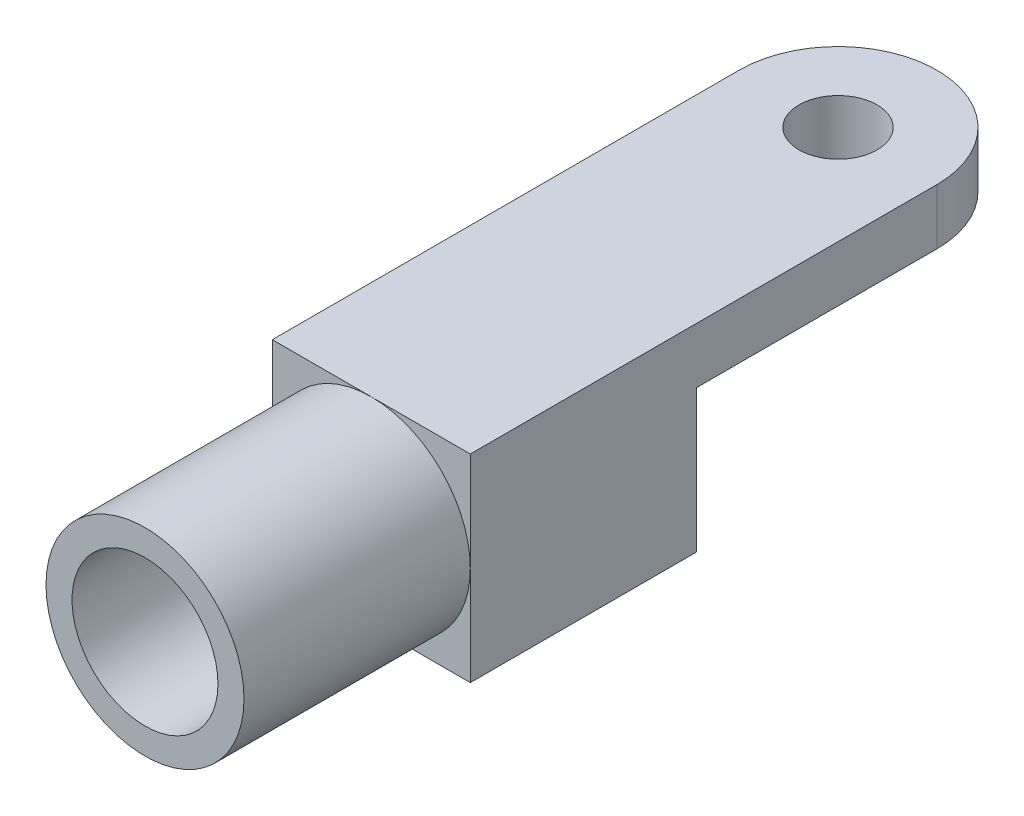
from build123d import *

# Parameters (mm, degrees)
SKETCH1_R           = 4.445
SKETCH1_R_2         = 3.275000003
BOSS_EXTRUDE1_DEPTH = 10.16
SKETCH2_W           = 8.89
SKETCH2_H           = 8.89
BOSS_EXTRUDE2_DEPTH = 25.4
CUT_EXTRUDE1_DEPTH  = 28.275449126
SKETCH4_W           = 15.24
SKETCH4_H           = 6.39064
CUT_EXTRUDE2_DEPTH  = 28.275449126


with BuildPart() as part:
    # Sketch1 → Boss-Extrude1 (new body)
    with BuildSketch(Plane.XY):
        Circle(SKETCH1_R)
        Circle(SKETCH1_R_2, mode=Mode.SUBTRACT)
    extrude(amount=BOSS_EXTRUDE1_DEPTH)

    # Sketch2 → Boss-Extrude2 (add)
    with BuildSketch(Plane(origin=(0, 0, 0), x_dir=(-1, 0, 0), z_dir=(0, 0, -1))):
        Rectangle(SKETCH2_W, SKETCH2_H)
    extrude(amount=BOSS_EXTRUDE2_DEPTH)

    # Sketch3 → Cut-Extrude1 (cut, through all)
    with BuildSketch(Plane.XZ.offset(4.445)):
        with BuildLine():
            Line((4.445, -25.4), (4.445, -20.955))
            ThreePointArc((4.445, -20.955), (3.143089642, -24.098089642), (0, -25.4))
            Line((0, -25.4), (4.445, -25.4))
        make_face()
        with BuildLine():
            ThreePointArc((0, -25.4), (-3.143089642, -24.098089642), (-4.445, -20.955))
            Line((-4.445, -20.955), (-4.445, -25.4))
            Line((-4.445, -25.4), (0, -25.4))
        make_face()
        with BuildLine():
            ThreePointArc((1.7526, -20.955), (0, -19.2024), (-1.7526, -20.955))
            Line((-1.7526, -20.955), (1.7526, -20.955))
        make_face()
        with BuildLine():
            Line((1.7526, -20.955), (-1.7526, -20.955))
            ThreePointArc((-1.7526, -20.955), (0, -22.7076), (1.7526, -20.955))
        make_face()
    extrude(amount=-CUT_EXTRUDE1_DEPTH, mode=Mode.SUBTRACT)

    # Sketch4 → Cut-Extrude2 (cut, through all)
    with BuildSketch(Plane.ZY.offset(4.445)):
        with Locations((-17.78, -1.24968)):
            Rectangle(SKETCH4_W, SKETCH4_H)
    extrude(amount=-CUT_EXTRUDE2_DEPTH, mode=Mode.SUBTRACT)


solid = part.part
